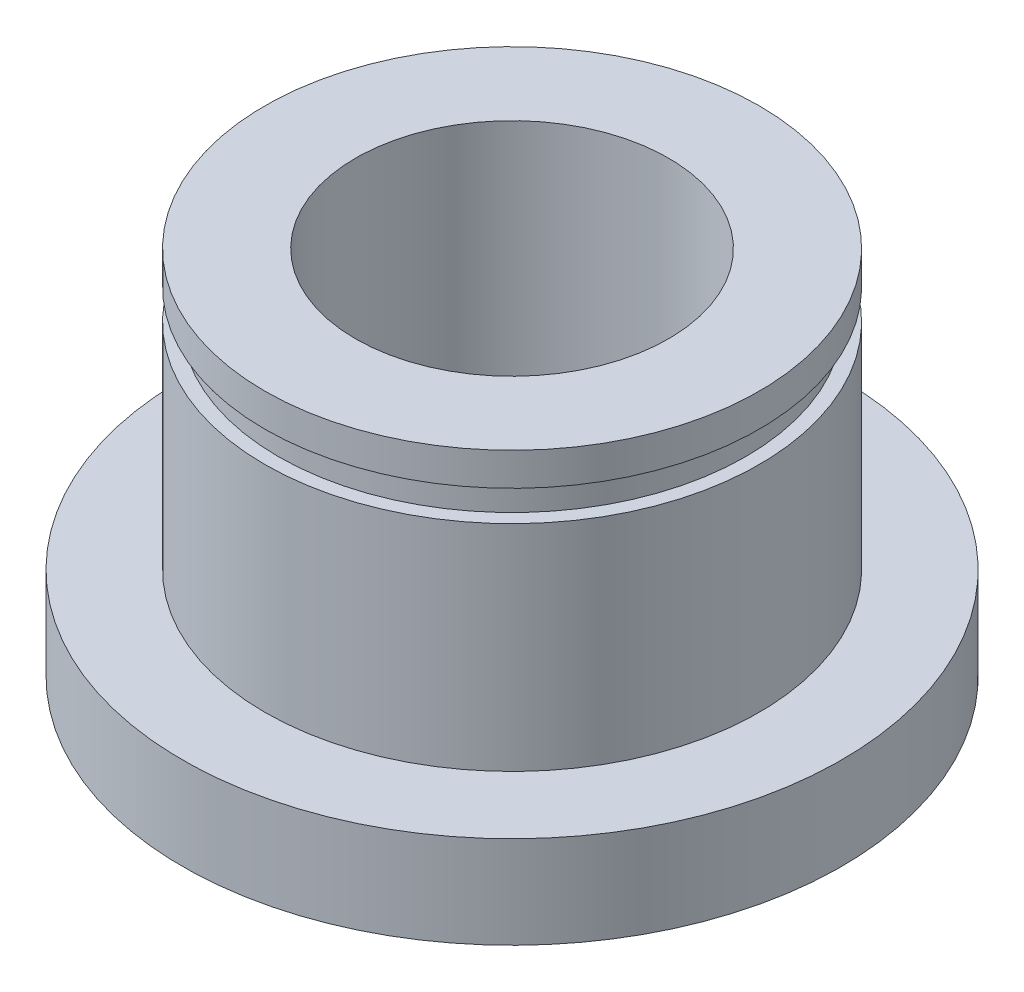
from build123d import *

# Parameters (mm, degrees)
F_19_64_0_29688_DIAMETER_HOLE1_D = 7.540752
CHAMFER1_SIZE                    = 0.79375


with BuildPart() as part:
    # Sketch1 → Revolve1 (revolve)
    with BuildSketch(Plane(origin=(0, 0, 0), x_dir=(0, 0, -1), z_dir=(1, 0, 0)), mode=Mode.PRIVATE) as revolve1_sk:
        Polygon((0, -4.460875), (-7.9375, -4.460875), (-7.9375, -2.238375), (-5.953125, -2.238375), (-5.953125, 2.930525), (-5.6261, 2.930525), (-5.6261, 3.667125), (-5.953125, 3.667125), (-5.953125, 4.460875), (0, 4.460875), align=None)
    revolve(revolve1_sk.sketch.rotate(Axis((0, 0, 0), (0, 1, 0)), 180), axis=Axis((0, 0, 0), (0, 1, 0)))

    # 19/64 (0.29688) Diameter Hole1 (through all)
    with Locations(Plane(origin=(0, 4.460875, 0), x_dir=(1, 0, 0), z_dir=(0, 1, 0))):
        with Locations((0, 0)):
            Hole(F_19_64_0_29688_DIAMETER_HOLE1_D / 2)

    # Chamfer1
    chamfer1_edges = [part.edges().sort_by_distance(p)[0] for p in [
        (3.770376, -4.460875, 0),
    ]]
    chamfer(chamfer1_edges, length=CHAMFER1_SIZE)


solid = part.part
